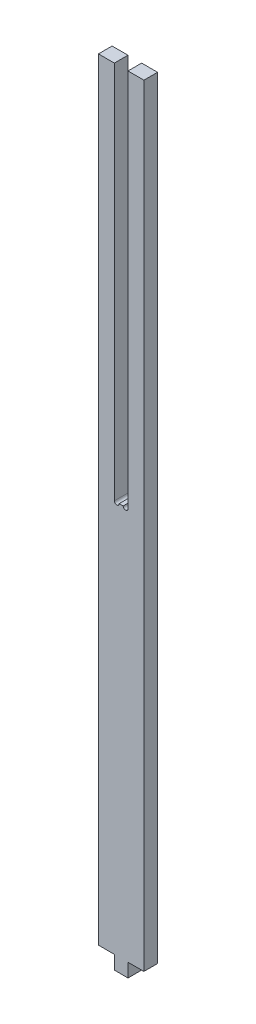
from build123d import *

# Parameters (mm, degrees)
ESTRUSIONE_ESTRUSIONE1_DEPTH = 18


with BuildPart() as part:
    # Schizzo1 → Estrusione-Estrusione1 (new body)
    with BuildSketch(Plane.XY):
        with BuildLine():
            Line((-51.222222222, 843), (-51.222222222, 343))
            ThreePointArc((-51.222222222, 343), (-48.047222222, 339.825), (-44.872222222, 343))
            Line((-44.872222222, 343), (-39.572222222, 343))
            ThreePointArc((-39.572222222, 343), (-36.397222222, 339.825), (-33.222222222, 343))
            Line((-33.222222222, 343), (-33.222222222, 843))
            Line((-33.222222222, 843), (-12.222222222, 843))
            Line((-12.222222222, 843), (-12.222222222, -175))
            Line((-12.222222222, -175), (-33.222222222, -175))
            Line((-33.222222222, -175), (-33.222222222, -193))
            Line((-33.222222222, -193), (-51.222222222, -193))
            Line((-51.222222222, -193), (-51.222222222, -175))
            Line((-51.222222222, -175), (-72.222222222, -175))
            Line((-72.222222222, -175), (-72.222222222, 843))
            Line((-72.222222222, 843), (-51.222222222, 843))
        make_face()
    extrude(amount=ESTRUSIONE_ESTRUSIONE1_DEPTH)


solid = part.part
